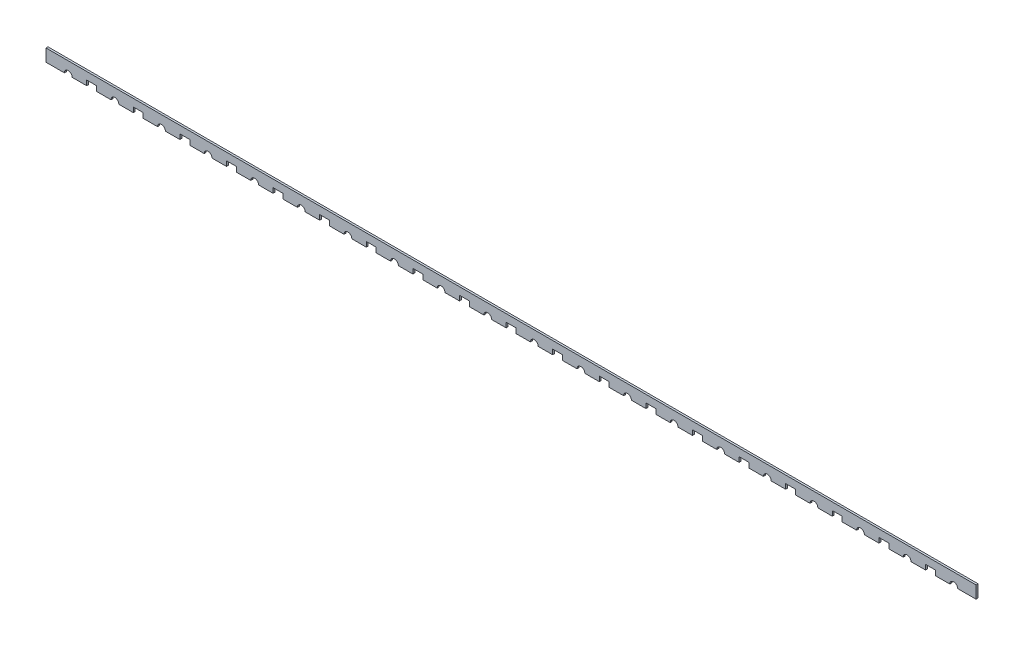
from build123d import *

# Parameters (mm, degrees)
BOSS_EXTRUDE1_DEPTH = 4


with BuildPart() as part:
    # Sketch1 → Boss-Extrude1 (new body)
    with BuildSketch(Plane.XY):
        with BuildLine():
            Line((0, 0), (-131.1, 0))
            Line((-131.1, 0), (-1876, 0))
            Line((-1876, 0), (-1876, -25))
            Line((-1876, -25), (-1868, -25))
            Line((-1868, -25), (-1838.9, -25))
            ThreePointArc((-1838.9, -25), (-1831, -17.1), (-1823.1, -25))
            Line((-1823.1, -25), (-1794, -25))
            Line((-1794, -25), (-1794, -15))
            Line((-1794, -15), (-1774, -15))
            Line((-1774, -15), (-1774, -25))
            Line((-1774, -25), (-1744.9, -25))
            ThreePointArc((-1744.9, -25), (-1737, -17.1), (-1729.1, -25))
            Line((-1729.1, -25), (-1700, -25))
            Line((-1700, -25), (-1700, -15))
            Line((-1700, -15), (-1680, -15))
            Line((-1680, -15), (-1680, -25))
            Line((-1680, -25), (-1650.9, -25))
            ThreePointArc((-1650.9, -25), (-1643, -17.1), (-1635.1, -25))
            Line((-1635.1, -25), (-1606, -25))
            Line((-1606, -25), (-1606, -15))
            Line((-1606, -15), (-1586, -15))
            Line((-1586, -15), (-1586, -25))
            Line((-1586, -25), (-1556.9, -25))
            ThreePointArc((-1556.9, -25), (-1549, -17.1), (-1541.1, -25))
            Line((-1541.1, -25), (-1512, -25))
            Line((-1512, -25), (-1512, -15))
            Line((-1512, -15), (-1492, -15))
            Line((-1492, -15), (-1492, -25))
            Line((-1492, -25), (-1462.9, -25))
            ThreePointArc((-1462.9, -25), (-1455, -17.1), (-1447.1, -25))
            Line((-1447.1, -25), (-1418, -25))
            Line((-1418, -25), (-1418, -15))
            Line((-1418, -15), (-1398, -15))
            Line((-1398, -15), (-1398, -25))
            Line((-1398, -25), (-1368.9, -25))
            ThreePointArc((-1368.9, -25), (-1361, -17.1), (-1353.1, -25))
            Line((-1353.1, -25), (-1324, -25))
            Line((-1324, -25), (-1324, -15))
            Line((-1324, -15), (-1304, -15))
            Line((-1304, -15), (-1304, -25))
            Line((-1304, -25), (-1274.9, -25))
            ThreePointArc((-1274.9, -25), (-1267, -17.1), (-1259.1, -25))
            Line((-1259.1, -25), (-1230, -25))
            Line((-1230, -25), (-1230, -15))
            Line((-1230, -15), (-1210, -15))
            Line((-1210, -15), (-1210, -25))
            Line((-1210, -25), (-1180.9, -25))
            ThreePointArc((-1180.9, -25), (-1173, -17.1), (-1165.1, -25))
            Line((-1165.1, -25), (-1136, -25))
            Line((-1136, -25), (-1136, -15))
            Line((-1136, -15), (-1116, -15))
            Line((-1116, -15), (-1116, -25))
            Line((-1116, -25), (-1086.9, -25))
            ThreePointArc((-1086.9, -25), (-1079, -17.1), (-1071.1, -25))
            Line((-1071.1, -25), (-1042, -25))
            Line((-1042, -25), (-1042, -15))
            Line((-1042, -15), (-1022, -15))
            Line((-1022, -15), (-1022, -25))
            Line((-1022, -25), (-992.9, -25))
            ThreePointArc((-992.9, -25), (-985, -17.1), (-977.1, -25))
            Line((-977.1, -25), (-948, -25))
            Line((-948, -25), (-948, -15))
            Line((-948, -15), (-928, -15))
            Line((-928, -15), (-928, -25))
            Line((-928, -25), (-898.9, -25))
            ThreePointArc((-898.9, -25), (-891, -17.1), (-883.1, -25))
            Line((-883.1, -25), (-854, -25))
            Line((-854, -25), (-854, -15))
            Line((-854, -15), (-834, -15))
            Line((-834, -15), (-834, -25))
            Line((-834, -25), (-804.9, -25))
            ThreePointArc((-804.9, -25), (-797, -17.1), (-789.1, -25))
            Line((-789.1, -25), (-760, -25))
            Line((-760, -25), (-760, -15))
            Line((-760, -15), (-740, -15))
            Line((-740, -15), (-740, -25))
            Line((-740, -25), (-710.9, -25))
            ThreePointArc((-710.9, -25), (-703, -17.1), (-695.1, -25))
            Line((-695.1, -25), (-666, -25))
            Line((-666, -25), (-666, -15))
            Line((-666, -15), (-646, -15))
            Line((-646, -15), (-646, -25))
            Line((-646, -25), (-616.9, -25))
            ThreePointArc((-616.9, -25), (-609, -17.1), (-601.1, -25))
            Line((-601.1, -25), (-572, -25))
            Line((-572, -25), (-572, -15))
            Line((-572, -15), (-552, -15))
            Line((-552, -15), (-552, -25))
            Line((-552, -25), (-522.9, -25))
            ThreePointArc((-522.9, -25), (-515, -17.1), (-507.1, -25))
            Line((-507.1, -25), (-478, -25))
            Line((-478, -25), (-478, -15))
            Line((-478, -15), (-458, -15))
            Line((-458, -15), (-458, -25))
            Line((-458, -25), (-428.9, -25))
            ThreePointArc((-428.9, -25), (-421, -17.1), (-413.1, -25))
            Line((-413.1, -25), (-384, -25))
            Line((-384, -25), (-384, -15))
            Line((-384, -15), (-364, -15))
            Line((-364, -15), (-364, -25))
            Line((-364, -25), (-334.9, -25))
            ThreePointArc((-334.9, -25), (-327, -17.1), (-319.1, -25))
            Line((-319.1, -25), (-290, -25))
            Line((-290, -25), (-290, -15))
            Line((-290, -15), (-270, -15))
            Line((-270, -15), (-270, -25))
            Line((-270, -25), (-240.9, -25))
            ThreePointArc((-240.9, -25), (-233, -17.1), (-225.1, -25))
            Line((-225.1, -25), (-196, -25))
            Line((-196, -25), (-196, -15))
            Line((-196, -15), (-176, -15))
            Line((-176, -15), (-176, -25))
            Line((-176, -25), (-146.9, -25))
            ThreePointArc((-146.9, -25), (-139, -17.1), (-131.1, -25))
            Line((-131.1, -25), (-102, -25))
            Line((-102, -25), (-102, -15))
            Line((-102, -15), (-82, -15))
            Line((-82, -15), (-82, -25))
            Line((-82, -25), (-52.9, -25))
            ThreePointArc((-52.9, -25), (-45, -17.1), (-37.1, -25))
            Line((-37.1, -25), (0, -25))
            Line((0, -25), (0, 0))
        make_face()
    extrude(amount=BOSS_EXTRUDE1_DEPTH)


solid = part.part
